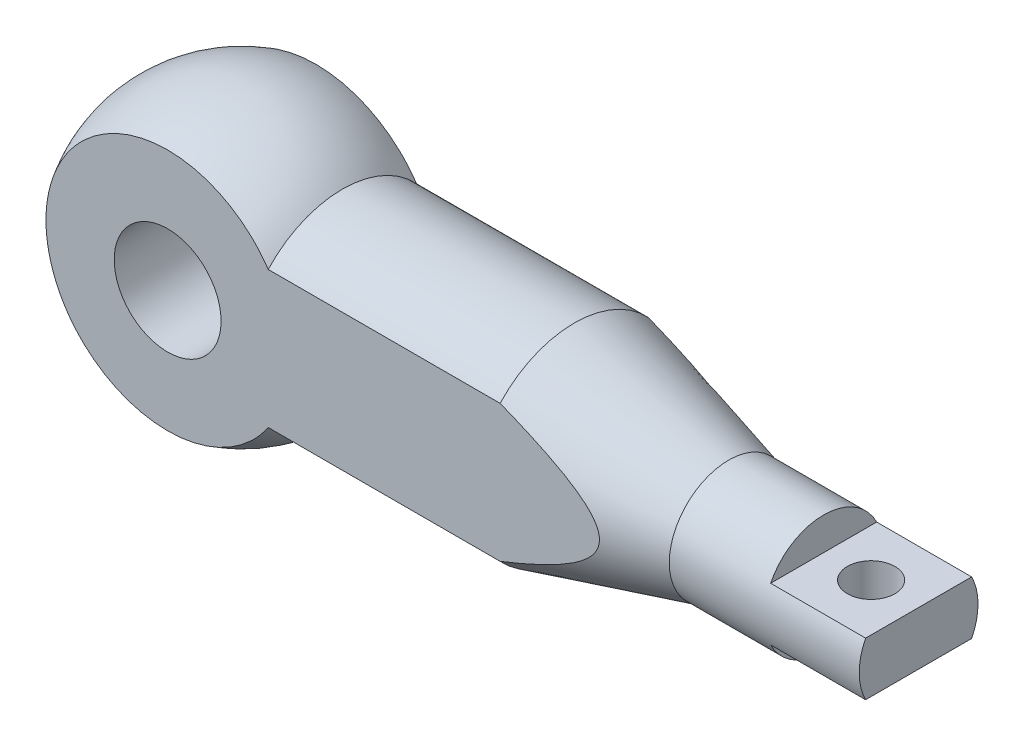
from build123d import *

# Parameters (mm, degrees)
CORTAR_EXTRUIR1_DEPTH      = 226.603802328
CORTAR_EXTRUIR1_DEPTH_BACK = 226.603802328
CORTAR_EXTRUIR2_START      = -25.4
CORTAR_EXTRUIR2_DEPTH      = 25.4
CORTAR_EXTRUIR3_REACH      = 189.595
CROQUIS5_R                 = 6.35
CORTAR_EXTRUIR4_REACH      = 191.15
CROQUIS6_R                 = 14.2875


with BuildPart() as part:
    # Croquis2 → Revolución1 (revolve)
    with BuildSketch(Plane.XY, mode=Mode.PRIVATE) as revoluci_n1_sk:
        with BuildLine():
            Line((-38.1, 0), (180.975, 0))
            Line((180.975, 0), (180.975, 15.875))
            Line((180.975, 15.875), (130.175, 15.875))
            Line((130.175, 15.875), (88.9, 26.9875))
            Line((88.9, 26.9875), (26.893955524, 26.9875))
            ThreePointArc((26.893955524, 26.9875), (-14.610788728, 35.187140446), (-38.1, 0))
        make_face()
    revolve(revoluci_n1_sk.sketch.rotate(Axis((-38.1, 0, 0), (1, 0, 0)), 90), axis=Axis((-38.1, 0, 0), (1, 0, 0)))

    # Croquis3 → Cortar-Extruir1 (cut, two sides: drawn at the far end of the back side and taken through both)
    with BuildSketch(Plane(origin=(180.975, 0, 0), x_dir=(0, 0, -1), z_dir=(1, 0, 0)).offset(-CORTAR_EXTRUIR1_DEPTH_BACK)):
        with BuildLine():
            Line((-19.8374, 32.528257888), (-19.8374, -32.528257888))
            ThreePointArc((-19.8374, -32.528257888), (-38.1, 0), (-19.8374, 32.528257888))
        make_face()
        with BuildLine():
            Line((19.8374, 32.528257888), (19.8374, -32.528257888))
            ThreePointArc((19.8374, -32.528257888), (38.1, 0), (19.8374, 32.528257888))
        make_face()
    extrude(amount=CORTAR_EXTRUIR1_DEPTH + CORTAR_EXTRUIR1_DEPTH_BACK, mode=Mode.SUBTRACT)

    # Croquis4 → Cortar-Extruir2 (cut)
    with BuildSketch(Plane(origin=(180.975, 0, 0), x_dir=(0, 0, -1), z_dir=(1, 0, 0)).offset(CORTAR_EXTRUIR2_START)):
        with BuildLine():
            Line((-14.180026313, 7.1374), (14.180026313, 7.1374))
            ThreePointArc((14.180026313, 7.1374), (0, 15.875), (-14.180026313, 7.1374))
        make_face()
        with BuildLine():
            Line((-14.180026313, -7.1374), (14.180026313, -7.1374))
            ThreePointArc((14.180026313, -7.1374), (0, -15.875), (-14.180026313, -7.1374))
        make_face()
    extrude(amount=CORTAR_EXTRUIR2_DEPTH, mode=Mode.SUBTRACT)

    # Croquis5 → Cortar-Extruir3 (cut, up to next)
    with BuildSketch(Plane(origin=(0, 7.1374, 0), x_dir=(1, 0, 0), z_dir=(0, 1, 0)), mode=Mode.PRIVATE) as cortar_extruir3_sk1:
        with Locations(Location((168.275, 0, 0), (0, 0, 270))):
            Circle(CROQUIS5_R)
    cortar_extruir3_tool1 = extrude(cortar_extruir3_sk1.sketch, amount=-CORTAR_EXTRUIR3_REACH, mode=Mode.PRIVATE) & part.part
    add(cortar_extruir3_tool1.solids().sort_by_distance((168.275, 7.1374, 0))[0], mode=Mode.SUBTRACT)

    # Croquis6 → Cortar-Extruir4 (cut, up to next)
    with BuildSketch(Plane.XY.offset(19.8374), mode=Mode.PRIVATE) as cortar_extruir4_sk1:
        Circle(CROQUIS6_R)
    cortar_extruir4_tool1 = extrude(cortar_extruir4_sk1.sketch, amount=-CORTAR_EXTRUIR4_REACH, mode=Mode.PRIVATE) & part.part
    add(cortar_extruir4_tool1.solids().sort_by_distance((0, 0, 19.8374))[0], mode=Mode.SUBTRACT)


solid = part.part
